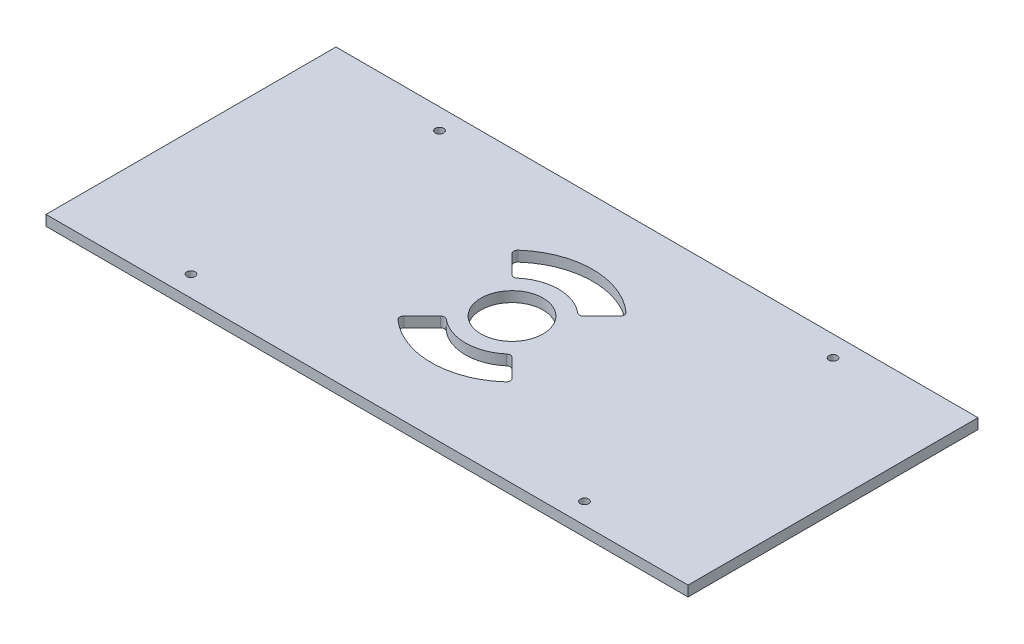
from build123d import *

# Parameters (mm, degrees)
SKETCH2_W           = 310
SKETCH2_H           = 140
BOSS_EXTRUDE1_DEPTH = 5
SKETCH3_R           = 15
CUT_EXTRUDE1_DEPTH  = 171.146995272
SKETCH5_R           = 2
CUT_EXTRUDE2_DEPTH  = 171.146995272
CUT_EXTRUDE3_DEPTH  = 10
FILLET1_R           = 2


with BuildPart() as part:
    # Sketch2 → Boss-Extrude1 (new body)
    with BuildSketch(Plane(origin=(0, 0, 0), x_dir=(1, 0, 0), z_dir=(0, 1, 0))):
        Rectangle(SKETCH2_W, SKETCH2_H)
    extrude(amount=BOSS_EXTRUDE1_DEPTH)

    # Sketch3 → Cut-Extrude1 (cut, through all)
    with BuildSketch(Plane(origin=(0, 5, 0), x_dir=(1, 0, 0), z_dir=(0, 1, 0))):
        with Locations(Location((0, 0, 0), (0, 0, 270))):
            Circle(SKETCH3_R)
    extrude(amount=-CUT_EXTRUDE1_DEPTH, mode=Mode.SUBTRACT)

    # Sketch5 → Cut-Extrude2 (cut, through all)
    with BuildSketch(Plane(origin=(0, 5, 0), x_dir=(1, 0, 0), z_dir=(0, 1, 0))):
        with Locations(Location((-95, 60, 0), (0, 0, 270))):
            Circle(SKETCH5_R)
        with Locations(Location((95, 60, 0), (0, 0, 90))):
            Circle(SKETCH5_R)
        with Locations(Location((95, -60, 0), (0, 0, 270))):
            Circle(SKETCH5_R)
        with Locations(Location((-95, -60, 0), (0, 0, 90))):
            Circle(SKETCH5_R)
    extrude(amount=-CUT_EXTRUDE2_DEPTH, mode=Mode.SUBTRACT)

    # Sketch6 → Cut-Extrude3 (cut)
    with BuildSketch(Plane(origin=(0, 5, 0), x_dir=(1, 0, 0), z_dir=(0, 1, 0))):
        with BuildLine():
            Line((27.577164466, -27.577164466), (15.909902577, -15.909902577))
            ThreePointArc((15.909902577, -15.909902577), (0, -22.5), (-15.909902577, -15.909902577))
            Line((-15.909902577, -15.909902577), (-27.577164466, -27.577164466))
            ThreePointArc((-27.577164466, -27.577164466), (0, -39), (27.577164466, -27.577164466))
        make_face()
        with BuildLine():
            ThreePointArc((-15.909902577, 15.909902577), (0, 22.5), (15.909902577, 15.909902577))
            Line((15.909902577, 15.909902577), (27.577164466, 27.577164466))
            ThreePointArc((27.577164466, 27.577164466), (0, 39), (-27.577164466, 27.577164466))
            Line((-27.577164466, 27.577164466), (-15.909902577, 15.909902577))
        make_face()
    extrude(amount=-CUT_EXTRUDE3_DEPTH, mode=Mode.SUBTRACT)

    # Fillet1
    fillet1_edges = [part.edges().sort_by_distance(p)[0] for p in [
        (-15.909902577, 2.5, 15.909902577),
        (15.909902577, 2.5, 15.909902577),
        (27.577164466, 2.5, 27.577164466),
        (-27.577164466, 2.5, 27.577164466),
        (15.909902577, 2.5, -15.909902577),
        (-15.909902577, 2.5, -15.909902577),
        (-27.577164466, 2.5, -27.577164466),
        (27.577164466, 2.5, -27.577164466),
    ]]
    fillet(fillet1_edges, radius=FILLET1_R)


solid = part.part
